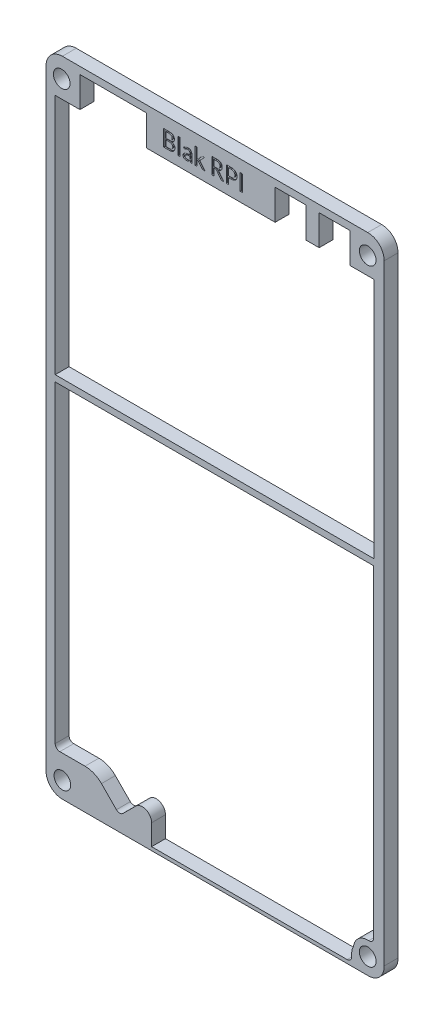
from build123d import *

# Parameters (mm, degrees)
MODEL_R                 = 1.809836942
MODEL_R_2               = 1.8
BOSS_EXTRU_1_DEPTH      = 3
ESQUISSE2_W             = 0.431189903
ESQUISSE2_H             = 3.58974359
ESQUISSE2_W_2           = 0.469751603
ESQUISSE2_H_2           = 3.5
ENL_V_MAT_EXTRU_1_DEPTH = 0.25
ESQUISSE3_W             = 4.589211434
ESQUISSE3_H             = 10.14724838
ENL_V_MAT_EXTRU_2_DEPTH = 10
ESQUISSE4_W             = 43.282716493
ESQUISSE4_H             = 19.200511783
ENL_V_MAT_EXTRU_3_DEPTH = 10
ESQUISSE5_W             = 8.711847795
ESQUISSE5_H             = 8.304842012
ENL_V_MAT_EXTRU_4_DEPTH = 10
CONG_1_R                = 5
CONG_2_R                = 1
CONG_3_R                = 2
CONG_4_R                = 2
CONG_5_R                = 1
ESQUISSE6_W             = 14.430377461
ESQUISSE6_H             = 6.577836
ENL_V_MAT_EXTRU_5_DEPTH = 10


with BuildPart() as part:
    # Model → Boss.-Extru.1 (new body)
    with BuildSketch(Plane.XY):
        with BuildLine():
            Line((128.905, -88.241118767), (106.045, -88.241118767))
            Line((106.045, -88.241118767), (62.865, -88.241118767))
            ThreePointArc((62.865, -88.241118767), (60.366111032, -89.276192468), (59.33103733, -91.775081437))
            Line((59.33103733, -91.775081437), (59.33103733, -223.85777033))
            ThreePointArc((59.33103733, -223.85777033), (60.366111032, -226.356659298), (62.865, -227.391733))
            Line((62.865, -227.391733), (128.898176953, -227.391733))
            ThreePointArc((128.898176953, -227.391733), (131.447277728, -226.393080044), (132.445419336, -223.843779))
            Line((132.445419336, -223.843779), (132.445419336, -91.779608456))
            ThreePointArc((132.445419336, -91.779608456), (131.433274754, -89.251885129), (128.905, -88.241118767))
        make_face()
        with Locations((128.904999648, -223.843792926)):
            Circle(MODEL_R, mode=Mode.SUBTRACT)
        with Locations((62.865, -223.843779)):
            Circle(MODEL_R_2, mode=Mode.SUBTRACT)
        with Locations((62.721615001, -92.543813)):
            Circle(MODEL_R_2, mode=Mode.SUBTRACT)
        with Locations((128.898176957, -92.543813)):
            Circle(MODEL_R_2, mode=Mode.SUBTRACT)
        with BuildLine():
            Line((61.316674, -201.436059), (61.316674, -212.195699974))
            ThreePointArc((61.316674, -212.195699974), (61.609567219, -212.902806755), (62.316674, -213.195699974))
            Line((62.316674, -213.195699974), (63.937923011, -213.195699974))
            ThreePointArc((63.937923011, -213.195699974), (64.323223557, -213.272908833), (64.649026872, -213.492612995))
            Line((64.649026872, -213.492612995), (74.553116007, -223.50963255))
            ThreePointArc((74.553116007, -223.50963255), (75.26138546, -223.806541554), (75.971326648, -223.513652352))
            Line((75.971326648, -223.513652352), (84.238225219, -215.246753781))
            ThreePointArc((84.238225219, -215.246753781), (85.328015432, -215.02998103), (85.945332, -215.953860562))
            Line((85.945332, -215.953860562), (85.945332, -223.224779))
            ThreePointArc((85.945332, -223.224779), (86.238225219, -223.931885781), (86.945332, -224.224779))
            Line((86.945332, -224.224779), (123.709679703, -224.224779))
            Line((123.709679703, -224.224779), (124.852667414, -224.224779))
            ThreePointArc((124.852667414, -224.224779), (125.504202764, -223.983397275), (125.841200661, -223.375782376))
            ThreePointArc((125.841200661, -223.375782376), (126.969896749, -221.42278593), (129.123597856, -220.752173136))
            ThreePointArc((129.123597856, -220.752173136), (129.875842989, -220.486281797), (130.194128461, -219.75466352))
            Line((130.194128461, -219.75466352), (130.194128461, -219.09666877))
            Line((130.194128461, -219.09666877), (130.194128461, -210.864423))
            Line((130.194128461, -210.864423), (130.194131279, -201.436059))
            Line((130.194131279, -201.436059), (130.19414665, -150.015421))
            Line((130.19414665, -150.015421), (61.316674, -150.015421))
            Line((61.316674, -150.015421), (61.316674, -201.436059))
        make_face(mode=Mode.SUBTRACT)
        Polygon((108.93964, -89.763996), (115.517186, -89.763996), (115.517186, -96.340384), (118.394607, -96.340384), (118.394607, -89.781055), (118.453599, -89.782503), (125.031144, -89.782503), (125.031144, -96.340384), (130.209976814, -96.340384), (130.209976814, -148.657210932), (61.316674, -148.657210932), (61.316674, -96.340384), (108.880648, -96.340384), (108.880648, -89.762548), align=None, mode=Mode.SUBTRACT)
    extrude(amount=BOSS_EXTRU_1_DEPTH)

    # Esquisse2 → Enlèv. mat.-Extru.1 (cut)
    # profile 1 of 7: a face of its own
    with BuildSketch(Plane(origin=(15.452462535, -0.515082084, 3), x_dir=(1, 0, 0), z_dir=(0, 0, 1))):
        with BuildLine():
            Line((69.30977488, -93.785368139), (69.30977488, -90.285368139))
            Line((69.30977488, -90.285368139), (70.417547316, -90.285368139))
            add(Edge.make_bspline(
                [(70.417547316, -90.285368139), (70.468988433, -90.286169799), (70.568509975, -90.287720747), (70.71204418, -90.299718399), (70.84479558, -90.318776499), (70.966351774, -90.346997049), (71.077645182, -90.38175822), (71.178506407, -90.423716772), (71.268817524, -90.472787656), (71.348755129, -90.528799362), (71.419801966, -90.590264765), (71.479574132, -90.660010332), (71.53089765, -90.735418912), (71.571250098, -90.818071013), (71.602891165, -90.906034195), (71.625356222, -90.999581772), (71.63884625, -91.09850494), (71.640275721, -91.166401412), (71.641004848, -91.201033203)],
                knots=[0, 0, 0, 0, 1.420138889, 2.747498888, 3.974001973, 5.119783414, 6.189154852, 7.189834797, 8.131232881, 9.020920902, 9.880473485, 10.71757059, 11.549778767, 12.392428487, 13.249701278, 14.126139542, 15.044204467, 16, 16, 16, 16], degree=3))
            add(Edge.make_bspline(
                [(71.641004848, -91.201033203), (71.63921535, -91.243519282), (71.635649515, -91.328178965), (71.609151542, -91.431123143), (71.579575745, -91.510050146), (71.551217054, -91.566886087), (71.518132705, -91.621719879), (71.480342949, -91.674610311), (71.436622418, -91.724331258), (71.387845241, -91.771387603), (71.334522311, -91.81657197), (71.275593899, -91.85840554), (71.211798465, -91.897214217), (71.142284439, -91.931306133), (71.068184521, -91.963426516), (71.015764463, -91.980410186), (70.988961579, -91.9890941)],
                knots=[0, 0, 0, 0, 1.618813469, 3.225720926, 4.0272673, 4.832821306, 5.644863893, 6.468958997, 7.309486036, 8.167103942, 9.053087263, 9.973579392, 10.921730296, 11.898751649, 12.925611351, 14, 14, 14, 14], degree=3))
            add(Edge.make_bspline(
                [(70.988961579, -91.9890941), (71.019891115, -91.995768917), (71.080040319, -92.008749549), (71.166754077, -92.033337227), (71.247276926, -92.062025097), (71.322173485, -92.094244236), (71.391192969, -92.130701292), (71.454349036, -92.171515986), (71.512105802, -92.215507359), (71.563764019, -92.263641061), (71.609713332, -92.315519578), (71.648850659, -92.372075653), (71.682998198, -92.431894773), (71.710415478, -92.496135866), (71.731157715, -92.564409302), (71.746789551, -92.636344811), (71.756016542, -92.712409845), (71.756925697, -92.764509282), (71.757391066, -92.791177434)],
                knots=[0, 0, 0, 0, 1.24219816, 2.415724216, 3.53609377, 4.596455151, 5.614517752, 6.597054559, 7.545976577, 8.461475298, 9.36530996, 10.261425195, 11.157211469, 12.065738994, 12.9974667, 13.955002006, 14.953226385, 16, 16, 16, 16], degree=3))
            add(Edge.make_bspline(
                [(71.757391066, -92.791177434), (71.756570381, -92.827465038), (71.754963504, -92.898515183), (71.738719106, -93.002528328), (71.71388256, -93.101874584), (71.678095832, -93.196017262), (71.63197859, -93.284165491), (71.577435326, -93.366578926), (71.512683473, -93.442327891), (71.439039221, -93.511571354), (71.35657058, -93.574469832), (71.264768846, -93.629274711), (71.163783104, -93.676108253), (71.054553675, -93.715914425), (70.936934514, -93.747955652), (70.810955578, -93.76849432), (70.677559254, -93.783597954), (70.585863229, -93.784768091), (70.538841386, -93.785368139)],
                knots=[0, 0, 0, 0, 0.981876127, 1.922486836, 2.843391751, 3.750715838, 4.642300992, 5.532155194, 6.421041295, 7.334282513, 8.264554527, 9.223944951, 10.223285208, 11.274324778, 12.368834988, 13.518450732, 14.727458259, 16, 16, 16, 16], degree=3))
            Line((70.538841386, -93.785368139), (69.30977488, -93.785368139))
        make_face()
        with BuildLine():
            Line((69.780227604, -92.194522786), (69.780227604, -93.42639378))
            Line((69.780227604, -93.42639378), (70.531129047, -93.42639378))
            add(Edge.make_bspline(
                [(70.531129047, -93.42639378), (70.563403607, -93.425947218), (70.625987944, -93.42508128), (70.715987128, -93.415877256), (70.798978386, -93.401193561), (70.874915646, -93.381196855), (70.944230152, -93.354872174), (71.007260336, -93.324327224), (71.064092199, -93.289073492), (71.114343864, -93.248922148), (71.15780543, -93.203862046), (71.195326292, -93.154894667), (71.227451311, -93.102326595), (71.251341571, -93.044748385), (71.271515357, -92.984689863), (71.284206326, -92.92105333), (71.293183674, -92.8550014), (71.294156101, -92.809906289), (71.294650681, -92.786970703)],
                knots=[0, 0, 0, 0, 1.367067429, 2.650911693, 3.827974315, 4.935287156, 5.972555628, 6.964549101, 7.898713885, 8.800296966, 9.682642597, 10.544184545, 11.41026693, 12.28401391, 13.179595464, 14.090429677, 15.028783562, 16, 16, 16, 16], degree=3))
            add(Edge.make_bspline(
                [(71.294650681, -92.786970703), (71.294209848, -92.764730916), (71.293347422, -92.721222039), (71.283737302, -92.657869132), (71.269412603, -92.597754407), (71.247978017, -92.541494604), (71.221653854, -92.488367828), (71.187808796, -92.439796346), (71.149532145, -92.393753806), (71.104162203, -92.352534746), (71.053476826, -92.314896463), (70.996310911, -92.282862293), (70.933397098, -92.255334249), (70.864311404, -92.23302997), (70.789003028, -92.215683128), (70.707710986, -92.203051799), (70.620282157, -92.196393856), (70.560118867, -92.195160303), (70.529025681, -92.194522786)],
                knots=[0, 0, 0, 0, 0.971287599, 1.900181487, 2.794565478, 3.667337949, 4.526190481, 5.379007774, 6.248786163, 7.13796323, 8.051223397, 9.00275761, 9.995351522, 11.048441264, 12.170886588, 13.370010927, 14.640786827, 16, 16, 16, 16], degree=3))
            Line((70.529025681, -92.194522786), (69.780227604, -92.194522786))
        make_face(mode=Mode.SUBTRACT)
        with BuildLine():
            Line((69.780227604, -91.855880959), (70.400720393, -91.855880959))
            add(Edge.make_bspline(
                [(70.400720393, -91.855880959), (70.432763414, -91.855414357), (70.494630145, -91.854513468), (70.58403165, -91.845604362), (70.667024382, -91.833176175), (70.743297794, -91.812996807), (70.813245179, -91.78880001), (70.877227943, -91.759904812), (70.934460387, -91.726393766), (70.985995382, -91.688874123), (71.03068089, -91.64672129), (71.070091628, -91.600782675), (71.102179409, -91.550052462), (71.128221007, -91.495583425), (71.148596608, -91.437743689), (71.163192089, -91.377147107), (71.171833295, -91.313695925), (71.172841021, -91.270705143), (71.173356611, -91.248709485)],
                knots=[0, 0, 0, 0, 1.379994421, 2.664409936, 3.867815052, 4.991181687, 6.057937224, 7.053717134, 8.010398922, 8.910573279, 9.793865205, 10.65118082, 11.511447617, 12.371596561, 13.247338598, 14.14846972, 15.05268932, 16, 16, 16, 16], degree=3))
            add(Edge.make_bspline(
                [(71.173356611, -91.248709485), (71.172835924, -91.223448826), (71.171829993, -91.174647006), (71.163636408, -91.10411812), (71.148621117, -91.038912934), (71.128625429, -90.978587436), (71.102641703, -90.923386173), (71.070682084, -90.873772536), (71.033247198, -90.828951947), (70.989332451, -90.789688198), (70.939771982, -90.754890437), (70.883726502, -90.725588621), (70.821521197, -90.700244667), (70.752982968, -90.679480724), (70.677959168, -90.663248179), (70.596808001, -90.65263937), (70.509298369, -90.645199422), (70.448881508, -90.644635149), (70.417547316, -90.644342498)],
                knots=[0, 0, 0, 0, 1.090401768, 2.106579669, 3.058678621, 3.974371125, 4.845396257, 5.685001254, 6.515647119, 7.358579693, 8.220677023, 9.12338191, 10.082670637, 11.116722883, 12.211085102, 13.392535595, 14.647682288, 16, 16, 16, 16], degree=3))
            Line((70.417547316, -90.644342498), (69.780227604, -90.644342498))
            Line((69.780227604, -90.644342498), (69.780227604, -91.855880959))
        make_face(mode=Mode.SUBTRACT)
    # profile 2 of 7: a face of its own
    with BuildSketch(Plane(origin=(15.452462535, -0.515082084, 3), x_dir=(1, 0, 0), z_dir=(0, 0, 1))):
        with Locations((72.647465184, -91.990496344)):
            Rectangle(ESQUISSE2_W, ESQUISSE2_H)
    # profile 3 of 7: a face of its own
    with BuildSketch(Plane(origin=(15.452462535, -0.515082084, 3), x_dir=(1, 0, 0), z_dir=(0, 0, 1))):
        with BuildLine():
            Line((75.44248722, -93.790977113), (75.25108097, -93.790977113))
            add(Edge.make_bspline(
                [(75.25108097, -93.790977113), (75.232133746, -93.790072595), (75.197267471, -93.78840812), (75.155291494, -93.777404313), (75.130181752, -93.758546136), (75.1156832, -93.739109845), (75.104665798, -93.714435762), (75.100463904, -93.695726762), (75.098236419, -93.685808844)],
                knots=[0, 0, 0, 0, 1.649608521, 3.035574369, 3.672690527, 4.338249123, 5.11908128, 6, 6, 6, 6], degree=3))
            Line((75.098236419, -93.685808844), (75.049859015, -93.450231921))
            add(Edge.make_bspline(
                [(75.049859015, -93.450231921), (75.018312573, -93.478783478), (74.956831676, -93.534427641), (74.863025969, -93.611199158), (74.768166587, -93.679107482), (74.667995962, -93.734045811), (74.561724918, -93.777314), (74.448142592, -93.808468095), (74.324799537, -93.826881789), (74.239194668, -93.829087878), (74.194490425, -93.830239934)],
                knots=[0, 0, 0, 0, 1.059511315, 2.064882845, 3.01757277, 3.960541115, 4.903024343, 5.868851543, 6.887079922, 8, 8, 8, 8], degree=3))
            add(Edge.make_bspline(
                [(74.194490425, -93.830239934), (74.171098618, -93.829663274), (74.124889573, -93.828524118), (74.056676877, -93.820610497), (73.990593712, -93.807972915), (73.92681331, -93.790826429), (73.866522184, -93.767621965), (73.809979007, -93.739365964), (73.757283366, -93.70640907), (73.708407272, -93.668580716), (73.664737187, -93.624479229), (73.62519796, -93.575305435), (73.591001206, -93.52029739), (73.561265439, -93.460340461), (73.537221976, -93.394885643), (73.520527263, -93.323331445), (73.510874174, -93.246237321), (73.509499431, -93.192947982), (73.50879331, -93.165576472)],
                knots=[0, 0, 0, 0, 1.039425805, 2.053320352, 3.047337951, 4.027476978, 4.984169237, 5.913117079, 6.832376566, 7.742378064, 8.653031276, 9.584066905, 10.540759164, 11.525454832, 12.553873936, 13.632063883, 14.78373444, 16, 16, 16, 16], degree=3))
            add(Edge.make_bspline(
                [(73.50879331, -93.165576472), (73.509661457, -93.140949366), (73.511398496, -93.091674035), (73.527871239, -93.019190162), (73.552537327, -92.947921356), (73.587681615, -92.878294219), (73.634489657, -92.811180101), (73.693319674, -92.747591823), (73.764897174, -92.688820293), (73.848713075, -92.633957205), (73.94487186, -92.582602057), (74.055353203, -92.537548524), (74.178989682, -92.496309347), (74.316745553, -92.459678411), (74.469933255, -92.43043182), (74.638488755, -92.408976952), (74.823208745, -92.396535639), (74.95144869, -92.395094078), (75.018308534, -92.394342498)],
                knots=[0, 0, 0, 0, 0.632108554, 1.26475914, 1.901162674, 2.567370326, 3.262208537, 3.997612114, 4.78669397, 5.636346289, 6.568805638, 7.58394604, 8.69895444, 9.917006809, 11.244661172, 12.704214402, 14.281692085, 16, 16, 16, 16], degree=3))
            Line((75.018308534, -92.394342498), (75.018308534, -92.200131761))
            add(Edge.make_bspline(
                [(75.018308534, -92.200131761), (75.017865352, -92.176517498), (75.017008394, -92.13085588), (75.011547806, -92.064530424), (75.001751684, -92.002929568), (74.988419847, -91.945746316), (74.971805492, -91.892782588), (74.950717958, -91.844105908), (74.925566528, -91.79988437), (74.896489535, -91.760257894), (74.86429832, -91.724917385), (74.827943243, -91.694369271), (74.78794823, -91.668402549), (74.744128453, -91.647216484), (74.696694206, -91.631283609), (74.645823567, -91.619170906), (74.591053604, -91.612183197), (74.553250911, -91.611526678), (74.533833374, -91.611189453)],
                knots=[0, 0, 0, 0, 1.302086033, 2.517773145, 3.666024748, 4.738142795, 5.752889559, 6.722446649, 7.657477622, 8.551843316, 9.427350491, 10.286971092, 11.162667913, 12.050230832, 12.963065525, 13.916387345, 14.929742194, 16, 16, 16, 16], degree=3))
            add(Edge.make_bspline(
                [(74.533833374, -91.611189453), (74.508583619, -91.611839224), (74.460086419, -91.61308724), (74.3900202, -91.619461842), (74.32649701, -91.632911688), (74.252063664, -91.656048088), (74.170204001, -91.691595637), (74.08423877, -91.73924146), (74.01151421, -91.787546243), (73.950127071, -91.831025473), (73.89321709, -91.866533815), (73.852524628, -91.870734811), (73.833412701, -91.872707882)],
                knots=[0, 0, 0, 0, 0.99479006, 1.910693196, 2.766384556, 3.546670209, 4.9776989, 6.271377957, 7.41513469, 8.408305195, 9.252432626, 10, 10, 10, 10], degree=3))
            add(Edge.make_bspline(
                [(73.833412701, -91.872707882), (73.819631338, -91.871770569), (73.792480822, -91.869923978), (73.75622824, -91.851139541), (73.726947189, -91.824523686), (73.71241249, -91.802931179), (73.705107412, -91.792078876)],
                knots=[0, 0, 0, 0, 1.034541736, 2.038139743, 3.0139773, 4, 4, 4, 4], degree=3))
            Line((73.705107412, -91.792078876), (73.627282893, -91.653256761))
            add(Edge.make_bspline(
                [(73.627282893, -91.653256761), (73.661331209, -91.622687375), (73.728411811, -91.56246082), (73.836843272, -91.484726257), (73.948988498, -91.418887474), (74.065420493, -91.365203464), (74.187047297, -91.32333188), (74.314933295, -91.294312069), (74.448890781, -91.275251171), (74.540543849, -91.273458564), (74.58711863, -91.272547626)],
                knots=[0, 0, 0, 0, 1.036034777, 2.041153374, 3.01644596, 3.978294175, 4.941074611, 5.92488145, 6.945499664, 8, 8, 8, 8], degree=3))
            add(Edge.make_bspline(
                [(74.58711863, -91.272547626), (74.62057634, -91.273333137), (74.685871515, -91.274866119), (74.780870647, -91.287431519), (74.869916619, -91.309256194), (74.952740863, -91.339501522), (75.029762083, -91.376919799), (75.100868455, -91.420871531), (75.165199614, -91.47260968), (75.222892604, -91.531100702), (75.274054071, -91.595944744), (75.319602736, -91.666515694), (75.357332046, -91.744062018), (75.387912861, -91.827845645), (75.412336241, -91.91648331), (75.429864238, -92.009801312), (75.440558698, -92.107332761), (75.441836487, -92.17392897), (75.44248722, -92.2078441)],
                knots=[0, 0, 0, 0, 1.119918335, 2.185602767, 3.20091759, 4.183627922, 5.132001113, 6.063437706, 6.976283531, 7.889229957, 8.80819235, 9.737193638, 10.696032219, 11.688784384, 12.719569567, 13.770792782, 14.864742393, 16, 16, 16, 16], degree=3))
            Line((75.44248722, -92.2078441), (75.44248722, -93.790977113))
        make_face()
        with BuildLine():
            add(Edge.make_bspline(
                [(74.322795713, -93.51613737), (74.359341179, -93.515263613), (74.429389286, -93.513588851), (74.530083186, -93.495149924), (74.622946306, -93.466952092), (74.710154371, -93.428605031), (74.792305226, -93.380529448), (74.870829418, -93.32354684), (74.946989176, -93.258255849), (74.994175387, -93.208998208), (75.018308534, -93.183805639)],
                knots=[0, 0, 0, 0, 1.10141022, 2.111115589, 3.076904424, 4.02408467, 4.97827264, 5.943031355, 6.947973878, 8, 8, 8, 8], degree=3))
            Line((75.018308534, -93.183805639), (75.018308534, -92.663573267))
            add(Edge.make_bspline(
                [(75.018308534, -92.663573267), (74.970618575, -92.663807473), (74.878675287, -92.664259007), (74.746550792, -92.672403238), (74.625305893, -92.683838328), (74.515033661, -92.700455332), (74.415598586, -92.721927695), (74.32533687, -92.744447554), (74.24541073, -92.771801826), (74.174424464, -92.801098555), (74.113009715, -92.833264042), (74.060235812, -92.868396448), (74.016630531, -92.906892973), (73.981355015, -92.94804555), (73.955132794, -92.992070255), (73.936729415, -93.038480419), (73.924879712, -93.087392323), (73.923736955, -93.121103304), (73.92315629, -93.138232722)],
                knots=[0, 0, 0, 0, 1.75127301, 3.376345915, 4.859943613, 6.223246388, 7.469043026, 8.595379332, 9.637729993, 10.568739764, 11.413486542, 12.180087406, 12.891503178, 13.543246196, 14.163001987, 14.763925342, 15.371918625, 16, 16, 16, 16], degree=3))
            add(Edge.make_bspline(
                [(73.92315629, -93.138232722), (73.923583274, -93.154375709), (73.924402872, -93.18536228), (73.930013564, -93.230245327), (73.939608271, -93.271730371), (73.958199052, -93.321313361), (73.988716283, -93.376191928), (74.037355705, -93.430645467), (74.097375033, -93.470296919), (74.165850791, -93.4978271), (74.242231998, -93.512717392), (74.295391593, -93.514974049), (74.322795713, -93.51613737)],
                knots=[0, 0, 0, 0, 0.774986694, 1.487592189, 2.16801971, 2.814183054, 4.025073361, 5.161066747, 6.284577535, 7.447301256, 8.684067001, 10, 10, 10, 10], degree=3))
        make_face(mode=Mode.SUBTRACT)
    # profile 4 of 7: a face of its own
    with BuildSketch(Plane(origin=(15.452462535, -0.515082084, 3), x_dir=(1, 0, 0), z_dir=(0, 0, 1))):
        with BuildLine():
            Line((76.55586863, -90.195624549), (76.55586863, -92.304598908))
            Line((76.55586863, -92.304598908), (76.667346995, -92.304598908))
            add(Edge.make_bspline(
                [(76.667346995, -92.304598908), (76.682121373, -92.30398649), (76.709259533, -92.302861576), (76.748745186, -92.292844869), (76.78493703, -92.270026121), (76.805734911, -92.248596295), (76.81738706, -92.236590094)],
                knots=[0, 0, 0, 0, 1.037674505, 1.906041581, 2.826846098, 4, 4, 4, 4], degree=3))
            Line((76.81738706, -92.236590094), (77.592827765, -91.405059645))
            add(Edge.make_bspline(
                [(77.592827765, -91.405059645), (77.604697726, -91.392841914), (77.627160712, -91.369720801), (77.664930482, -91.340228992), (77.710423527, -91.320058039), (77.744261259, -91.318343519), (77.762499239, -91.317419421)],
                knots=[0, 0, 0, 0, 1.034338913, 1.957406553, 2.899075832, 4, 4, 4, 4], degree=3))
            Line((77.762499239, -91.317419421), (78.155127444, -91.317419421))
            Line((78.155127444, -91.317419421), (77.251381451, -92.287070863))
            add(Edge.make_bspline(
                [(77.251381451, -92.287070863), (77.240341653, -92.300318442), (77.219034905, -92.325886196), (77.185175002, -92.360447495), (77.149825097, -92.391513145), (77.123785086, -92.408224397), (77.11045597, -92.416778395)],
                knots=[0, 0, 0, 0, 1.074531676, 2.073840187, 3.014055403, 4, 4, 4, 4], degree=3))
            add(Edge.make_bspline(
                [(77.11045597, -92.416778395), (77.124791191, -92.426916644), (77.153185002, -92.446997501), (77.190401783, -92.48394935), (77.225560383, -92.52419754), (77.245851285, -92.554192817), (77.256289303, -92.569622947)],
                knots=[0, 0, 0, 0, 0.988958019, 1.958831814, 2.949985082, 4, 4, 4, 4], degree=3))
            Line((77.256289303, -92.569622947), (78.215423919, -93.785368139))
            Line((78.215423919, -93.785368139), (77.827703566, -93.785368139))
            add(Edge.make_bspline(
                [(77.827703566, -93.785368139), (77.811196684, -93.78461578), (77.779694709, -93.783179968), (77.735593506, -93.766818093), (77.697091343, -93.7391034), (77.67664682, -93.714404585), (77.665744431, -93.701233523)],
                knots=[0, 0, 0, 0, 1.038389849, 1.981678422, 2.923695795, 4, 4, 4, 4], degree=3))
            Line((77.665744431, -93.701233523), (76.858753245, -92.700732722))
            add(Edge.make_bspline(
                [(76.858753245, -92.700732722), (76.847430126, -92.685917906), (76.827246642, -92.659510464), (76.785819031, -92.631705223), (76.734994001, -92.62046575), (76.698231636, -92.619344229), (76.677162701, -92.618701472)],
                knots=[0, 0, 0, 0, 1.062487185, 1.893885712, 2.792961651, 4, 4, 4, 4], degree=3))
            Line((76.677162701, -92.618701472), (76.55586863, -92.618701472))
            Line((76.55586863, -92.618701472), (76.55586863, -93.785368139))
            Line((76.55586863, -93.785368139), (76.121874239, -93.785368139))
            Line((76.121874239, -93.785368139), (76.121874239, -90.195624549))
            Line((76.121874239, -90.195624549), (76.55586863, -90.195624549))
        make_face()
    # profile 5 of 7: a face of its own
    with BuildSketch(Plane(origin=(15.452462535, -0.515082084, 3), x_dir=(1, 0, 0), z_dir=(0, 0, 1))):
        with BuildLine():
            Line((80.191185136, -92.304598908), (80.191185136, -93.762932241))
            Line((80.191185136, -93.762932241), (79.723536899, -93.762932241))
            Line((79.723536899, -93.762932241), (79.723536899, -90.285368139))
            Line((79.723536899, -90.285368139), (80.705107412, -90.285368139))
            add(Edge.make_bspline(
                [(80.705107412, -90.285368139), (80.758190127, -90.286089031), (80.860775968, -90.287482203), (81.008940847, -90.300564915), (81.14623482, -90.31994396), (81.272263057, -90.349693939), (81.387485434, -90.386547783), (81.492324158, -90.430843848), (81.586886568, -90.482547163), (81.670619094, -90.54244176), (81.744461692, -90.608829083), (81.807959236, -90.68199259), (81.860921193, -90.762023756), (81.903859553, -90.848015598), (81.936742207, -90.939910476), (81.960699293, -91.037124139), (81.974753712, -91.13985925), (81.97666791, -91.210104779), (81.97764347, -91.245904998)],
                knots=[0, 0, 0, 0, 1.406608131, 2.718362824, 3.939545222, 5.078446507, 6.146050995, 7.142417242, 8.090617986, 8.996476549, 9.86483491, 10.716777373, 11.556882632, 12.401792631, 13.25807025, 14.13845254, 15.051273343, 16, 16, 16, 16], degree=3))
            add(Edge.make_bspline(
                [(81.97764347, -91.245904998), (81.977053609, -91.276091702), (81.975887946, -91.335745611), (81.964088324, -91.423669444), (81.94611488, -91.508632283), (81.920747458, -91.590299373), (81.888584355, -91.668333019), (81.849093269, -91.74214325), (81.803107037, -91.811879625), (81.751495205, -91.877991632), (81.692708277, -91.938881964), (81.628838642, -91.996389677), (81.557752332, -92.047880239), (81.481109482, -92.094993786), (81.399088923, -92.137006809), (81.311682279, -92.173602334), (81.219002362, -92.204410405), (81.154872415, -92.220632163), (81.12227488, -92.228877754)],
                knots=[0, 0, 0, 0, 1.021686097, 2.019020311, 2.998484701, 3.959714546, 4.910626426, 5.852404893, 6.789683516, 7.736469802, 8.688073027, 9.652230582, 10.643138444, 11.655710958, 12.696317932, 13.76046342, 14.861633674, 16, 16, 16, 16], degree=3))
            add(Edge.make_bspline(
                [(81.12227488, -92.228877754), (81.136493338, -92.238185619), (81.165291821, -92.257038043), (81.205884057, -92.291230817), (81.243381648, -92.331799783), (81.265814444, -92.362104103), (81.277222797, -92.377515575)],
                knots=[0, 0, 0, 0, 0.942421706, 1.908808604, 2.936510171, 4, 4, 4, 4], degree=3))
            Line((81.277222797, -92.377515575), (82.289642669, -93.762932241))
            Line((82.289642669, -93.762932241), (81.873176322, -93.762932241))
            add(Edge.make_bspline(
                [(81.873176322, -93.762932241), (81.853130179, -93.761855556), (81.814609996, -93.759786622), (81.761373961, -93.740189418), (81.715746841, -93.708170311), (81.694732699, -93.678173149), (81.683873438, -93.662671825)],
                knots=[0, 0, 0, 0, 1.068806385, 2.053792478, 2.994278391, 4, 4, 4, 4], degree=3))
            Line((81.683873438, -93.662671825), (80.782931931, -92.41467503))
            add(Edge.make_bspline(
                [(80.782931931, -92.41467503), (80.769514566, -92.397081479), (80.744378456, -92.364121697), (80.702311411, -92.333299131), (80.664654578, -92.318168625), (80.631208201, -92.309800901), (80.591658384, -92.305113306), (80.563260036, -92.304778276), (80.54805613, -92.304598908)],
                knots=[0, 0, 0, 0, 1.455840538, 2.727373589, 3.377713729, 4.126068979, 4.996734937, 6, 6, 6, 6], degree=3))
            Line((80.54805613, -92.304598908), (80.191185136, -92.304598908))
        make_face()
        with BuildLine():
            Line((80.191185136, -91.965957081), (80.683372636, -91.965957081))
            add(Edge.make_bspline(
                [(80.683372636, -91.965957081), (80.716824244, -91.965602615), (80.781547846, -91.96491678), (80.875434709, -91.954409694), (80.963215913, -91.939532096), (81.044989187, -91.917927485), (81.120080028, -91.889604754), (81.189140388, -91.857019313), (81.251335508, -91.818528764), (81.308108171, -91.776211841), (81.356944619, -91.726943673), (81.401101214, -91.674908029), (81.436653727, -91.61697652), (81.4673792, -91.556052502), (81.490129427, -91.490387897), (81.507200794, -91.421443525), (81.516958456, -91.349013714), (81.518385552, -91.299685495), (81.519109816, -91.274650991)],
                knots=[0, 0, 0, 0, 1.308270289, 2.531297377, 3.692013173, 4.790080712, 5.83475335, 6.828719755, 7.772933257, 8.692966069, 9.591847989, 10.48175302, 11.357113121, 12.244618405, 13.147075345, 14.069785909, 15.020399435, 16, 16, 16, 16], degree=3))
            add(Edge.make_bspline(
                [(81.519109816, -91.274650991), (81.518349362, -91.249386115), (81.516872644, -91.200324476), (81.507942545, -91.128827588), (81.491954618, -91.062257496), (81.469200682, -91.000456089), (81.440703862, -90.943458356), (81.404998221, -90.891406918), (81.362770209, -90.844593336), (81.314684543, -90.802058775), (81.260101256, -90.764570501), (81.198937545, -90.732685954), (81.131834418, -90.705169912), (81.058570053, -90.682870904), (80.979074776, -90.665525626), (80.893360103, -90.652836041), (80.801264715, -90.646228991), (80.737835643, -90.644984587), (80.705107412, -90.644342498)],
                knots=[0, 0, 0, 0, 1.033258358, 2.006475222, 2.940617152, 3.826533373, 4.694167353, 5.539783748, 6.399326861, 7.266012896, 8.159372412, 9.099896797, 10.081337649, 11.121248473, 12.22730009, 13.40587258, 14.661478122, 16, 16, 16, 16], degree=3))
            Line((80.705107412, -90.644342498), (80.191185136, -90.644342498))
            Line((80.191185136, -90.644342498), (80.191185136, -91.965957081))
        make_face(mode=Mode.SUBTRACT)
    # profile 6 of 7: a face of its own
    with BuildSketch(Plane(origin=(15.452462535, -0.515082084, 3), x_dir=(1, 0, 0), z_dir=(0, 0, 1))):
        with BuildLine():
            Line((83.332210777, -92.484086088), (83.332210777, -93.785368139))
            Line((83.332210777, -93.785368139), (82.86456254, -93.785368139))
            Line((82.86456254, -93.785368139), (82.86456254, -90.285368139))
            Line((82.86456254, -90.285368139), (83.889602604, -90.285368139))
            add(Edge.make_bspline(
                [(83.889602604, -90.285368139), (83.942681525, -90.286336064), (84.045528396, -90.288211538), (84.194690011, -90.301884923), (84.332976278, -90.326402134), (84.460893428, -90.359936113), (84.577969723, -90.402573563), (84.684934409, -90.45327135), (84.78158506, -90.511860345), (84.86703016, -90.57998854), (84.942498046, -90.655101651), (85.007622913, -90.73802068), (85.062587185, -90.828101318), (85.106710705, -90.925518058), (85.140937649, -91.029267482), (85.166340812, -91.138785094), (85.18114402, -91.254379453), (85.182951486, -91.333269144), (85.183873438, -91.373509164)],
                knots=[0, 0, 0, 0, 1.325251343, 2.567835804, 3.735399269, 4.828104257, 5.865580719, 6.841757919, 7.779505967, 8.680815407, 9.563823694, 10.432348602, 11.307026619, 12.192249484, 13.096444448, 14.030681853, 14.995491041, 16, 16, 16, 16], degree=3))
            add(Edge.make_bspline(
                [(85.183873438, -91.373509164), (85.182697223, -91.413516549), (85.180384081, -91.492194988), (85.165084808, -91.607653141), (85.138113988, -91.717732152), (85.101239271, -91.822518632), (85.053181804, -91.920722489), (84.996350969, -92.012927887), (84.928386595, -92.097272821), (84.851027574, -92.174878521), (84.763469507, -92.244246696), (84.66679736, -92.306647443), (84.559611523, -92.359655616), (84.442983008, -92.404499304), (84.3172081, -92.440137001), (84.182611048, -92.46600829), (84.039078016, -92.481618186), (83.940357374, -92.483248105), (83.889602604, -92.484086088)],
                knots=[0, 0, 0, 0, 0.997544703, 1.961769344, 2.897396805, 3.81894563, 4.725897901, 5.618452442, 6.513950553, 7.42045343, 8.345073878, 9.29390941, 10.284194176, 11.320915622, 12.405499095, 13.539189434, 14.734835259, 16, 16, 16, 16], degree=3))
            Line((83.889602604, -92.484086088), (83.332210777, -92.484086088))
        make_face()
        with BuildLine():
            Line((83.332210777, -92.125111729), (83.889602604, -92.125111729))
            add(Edge.make_bspline(
                [(83.889602604, -92.125111729), (83.922123462, -92.124500633), (83.985473803, -92.123310224), (84.077305502, -92.112315457), (84.163717846, -92.096245656), (84.243593521, -92.070964909), (84.318350936, -92.041694477), (84.385600614, -92.004194409), (84.448329915, -91.964318926), (84.502974446, -91.91638429), (84.552405618, -91.864568342), (84.595570576, -91.807583572), (84.631203893, -91.745052279), (84.661686338, -91.678605225), (84.68445664, -91.60740759), (84.701427587, -91.53308951), (84.711340499, -91.455105276), (84.712716758, -91.402049419), (84.713420713, -91.374911408)],
                knots=[0, 0, 0, 0, 1.238068582, 2.41174654, 3.518507562, 4.579993339, 5.598200095, 6.570023242, 7.50816193, 8.423429822, 9.330130817, 10.232715399, 11.138060923, 12.066265649, 13.012058619, 13.979469194, 14.966500751, 16, 16, 16, 16], degree=3))
            add(Edge.make_bspline(
                [(84.713420713, -91.374911408), (84.712641578, -91.347080618), (84.711118368, -91.292671409), (84.702340864, -91.213247099), (84.686080097, -91.138629976), (84.663764291, -91.068767389), (84.63467122, -91.003755188), (84.599781399, -90.942900474), (84.557243697, -90.887632427), (84.509276739, -90.836399328), (84.454514222, -90.790815825), (84.393025249, -90.751334567), (84.324889822, -90.718340085), (84.250472746, -90.690977991), (84.169347832, -90.670300195), (84.081972861, -90.654788876), (83.987953365, -90.645697), (83.923042798, -90.644803042), (83.889602604, -90.644342498)],
                knots=[0, 0, 0, 0, 1.063970961, 2.080063754, 3.049001251, 3.978424966, 4.878183186, 5.766830926, 6.653005761, 7.537693535, 8.444695165, 9.368952983, 10.323787041, 11.332747334, 12.394428286, 13.519425349, 14.722074101, 16, 16, 16, 16], degree=3))
            Line((83.889602604, -90.644342498), (83.332210777, -90.644342498))
            Line((83.332210777, -90.644342498), (83.332210777, -92.125111729))
        make_face(mode=Mode.SUBTRACT)
    # profile 7 of 7: a face of its own
    with BuildSketch(Plane(origin=(15.452462535, -0.515082084, 3), x_dir=(1, 0, 0), z_dir=(0, 0, 1))):
        with Locations((86.100239624, -92.035368139)):
            Rectangle(ESQUISSE2_W_2, ESQUISSE2_H_2)
    extrude(amount=-ENL_V_MAT_EXTRU_1_DEPTH, mode=Mode.SUBTRACT)

    # Esquisse3 → Enlèv. mat.-Extru.2 (cut)
    with BuildSketch(Plane.XY.offset(3)):
        with Locations((84.457255568, -219.15115481)):
            Rectangle(ESQUISSE3_W, ESQUISSE3_H)
    extrude(amount=-ENL_V_MAT_EXTRU_2_DEPTH, mode=Mode.SUBTRACT)

    # Esquisse4 → Enlèv. mat.-Extru.3 (cut)
    with BuildSketch(Plane.XY.offset(3)):
        with Locations((103.804008098, -217.032530221)):
            Rectangle(ESQUISSE4_W, ESQUISSE4_H)
    extrude(amount=-ENL_V_MAT_EXTRU_3_DEPTH, mode=Mode.SUBTRACT)

    # Esquisse5 → Enlèv. mat.-Extru.4 (cut)
    with BuildSketch(Plane.XY.offset(3)):
        with Locations((65.672597897, -214.604328878)):
            Rectangle(ESQUISSE5_W, ESQUISSE5_H)
    extrude(amount=-ENL_V_MAT_EXTRU_4_DEPTH, mode=Mode.SUBTRACT)

    # Congé1
    cong_1_edges = [part.edges().sort_by_distance(p)[0] for p in [
        (69.853816648, -218.756749884, 1.5),
    ]]
    fillet(cong_1_edges, radius=CONG_1_R)

    # Congé2
    cong_2_edges = [part.edges().sort_by_distance(p)[0] for p in [
        (61.316674, -218.756749884, 1.5),
    ]]
    fillet(cong_2_edges, radius=CONG_2_R)

    # Congé3
    cong_3_edges = [part.edges().sort_by_distance(p)[0] for p in [
        (82.162649851, -217.322329149, 1.5),
    ]]
    fillet(cong_3_edges, radius=CONG_3_R)

    # Congé4
    cong_4_edges = [part.edges().sort_by_distance(p)[0] for p in [
        (125.445366344, -224.030203099, 1.5),
    ]]
    fillet(cong_4_edges, radius=CONG_4_R)

    # Congé5
    cong_5_edges = [part.edges().sort_by_distance(p)[0] for p in [
        (125.445366344, -226.632786113, 1.5),
    ]]
    fillet(cong_5_edges, radius=CONG_5_R)

    # Esquisse6 → Enlèv. mat.-Extru.5 (cut)
    with BuildSketch(Plane.XY.offset(3)):
        with Locations((73.879217611, -93.051466)):
            Rectangle(ESQUISSE6_W, ESQUISSE6_H)
    extrude(amount=-ENL_V_MAT_EXTRU_5_DEPTH, mode=Mode.SUBTRACT)


solid = part.part
